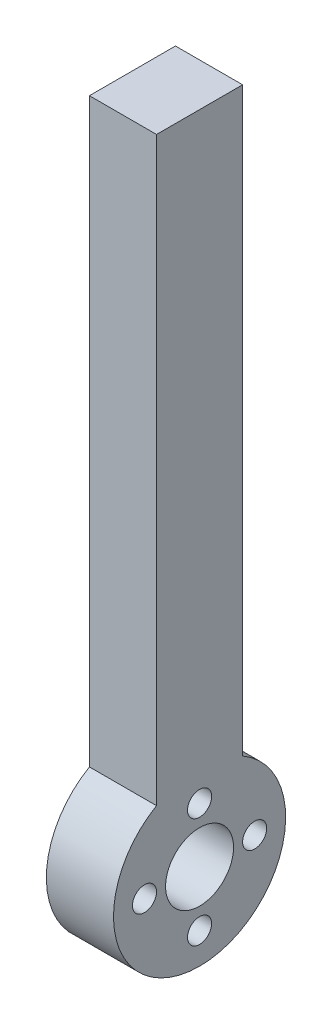
from build123d import *

# Parameters (mm, degrees)
SKETCH1_R           = 5.0165
SKETCH1_R_2         = 1.778
BOSS_EXTRUDE1_DEPTH = 9.906


with BuildPart() as part:
    # Sketch1 → Boss-Extrude1 (new body)
    with BuildSketch(Plane(origin=(0, 0, 0), x_dir=(0, 0, -1), z_dir=(1, 0, 0))):
        with BuildLine():
            Line((-6.35, -34.97547742), (-6.35, 50.8))
            Line((-6.35, 50.8), (6.35, 50.8))
            Line((6.35, 50.8), (6.35, -34.97547742))
            ThreePointArc((6.35, -34.97547742), (0, -58.674000048), (-6.35, -34.97547742))
        make_face()
        with Locations((0, -45.974000048)):
            Circle(SKETCH1_R, mode=Mode.SUBTRACT)
        with Locations((-8.128, -45.974000048)):
            Circle(SKETCH1_R_2, mode=Mode.SUBTRACT)
        with Locations((0, -37.846000048)):
            Circle(SKETCH1_R_2, mode=Mode.SUBTRACT)
        with Locations((8.128, -45.974000048)):
            Circle(SKETCH1_R_2, mode=Mode.SUBTRACT)
        with Locations((0, -54.102000048)):
            Circle(SKETCH1_R_2, mode=Mode.SUBTRACT)
    extrude(amount=BOSS_EXTRUDE1_DEPTH)


solid = part.part
